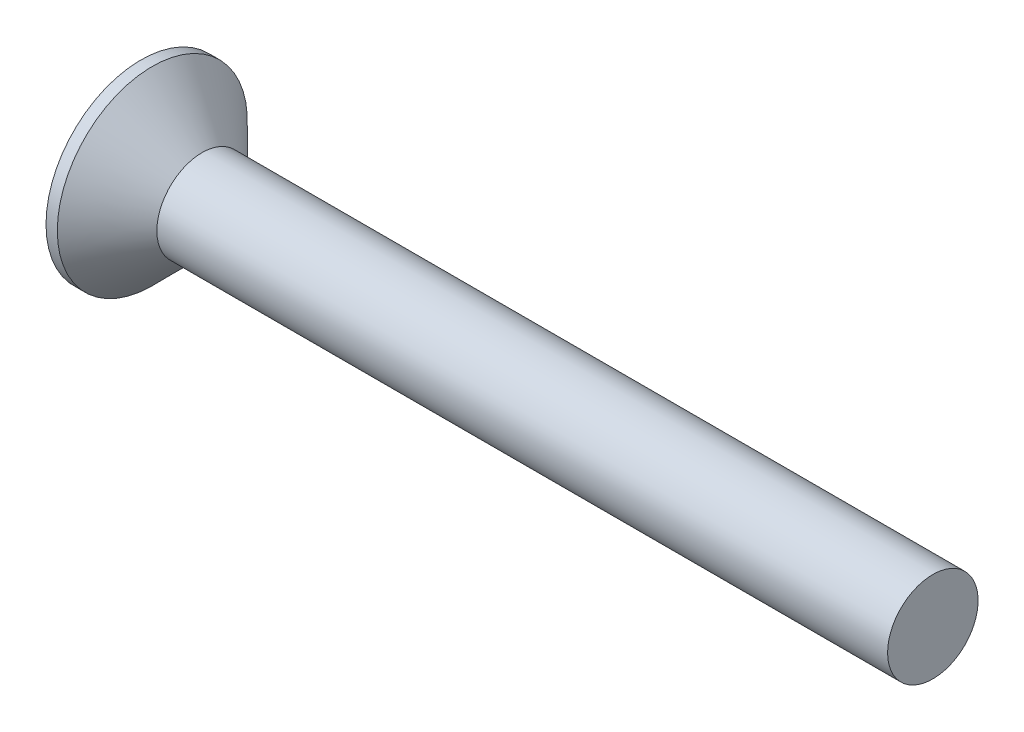
from build123d import *

# Parameters (mm, degrees)
CIRPATTERN1_COUNT = 2
CIRPATTERN1_ANGLE = 90


with BuildPart() as part:
    # BodySke → Base-Revolve (revolve)
    with BuildSketch(Plane.XY, mode=Mode.PRIVATE) as base_revolve_sk:
        Polygon((0, 0), (0, 4.2), (0.5, 4.2), (2.7, 2), (35, 2), (35, 0), align=None)
    revolve(base_revolve_sk.sketch.rotate(Axis((-6.35, 0, 0), (1, 0, 0)), 90), axis=Axis((-6.35, 0, 0), (1, 0, 0)))

    # Sketch3 → Cross section 0
    with BuildSketch(Plane.ZY):
        with BuildLine():
            Line((-0.48, 2.23), (0.48, 2.23))
            Line((0.48, 2.23), (0.48, -2.23))
            Line((0.48, -2.23), (-0.48, -2.23))
            Line((-0.48, -2.23), (-0.48, 2.23))
        make_face()
    # Sketch4 → Cross section 1
    with BuildSketch(Plane.ZY.offset(-2.65)):
        with BuildLine():
            Line((-0.24, 0.24), (0.24, 0.24))
            Line((0.24, 0.24), (0.24, -0.24))
            Line((0.24, -0.24), (-0.24, -0.24))
            Line((-0.24, -0.24), (-0.24, 0.24))
        make_face()
    cross = loft(mode=Mode.SUBTRACT)

    # CirPattern1: Cross ×2 about axis
    cirpattern1_axis = Axis((0, 0, 0), (1, 0, 0))
    for i in range(1, CIRPATTERN1_COUNT):
        add(cross.rotate(cirpattern1_axis, i * CIRPATTERN1_ANGLE / (CIRPATTERN1_COUNT - 1)), mode=Mode.SUBTRACT)


solid = part.part
